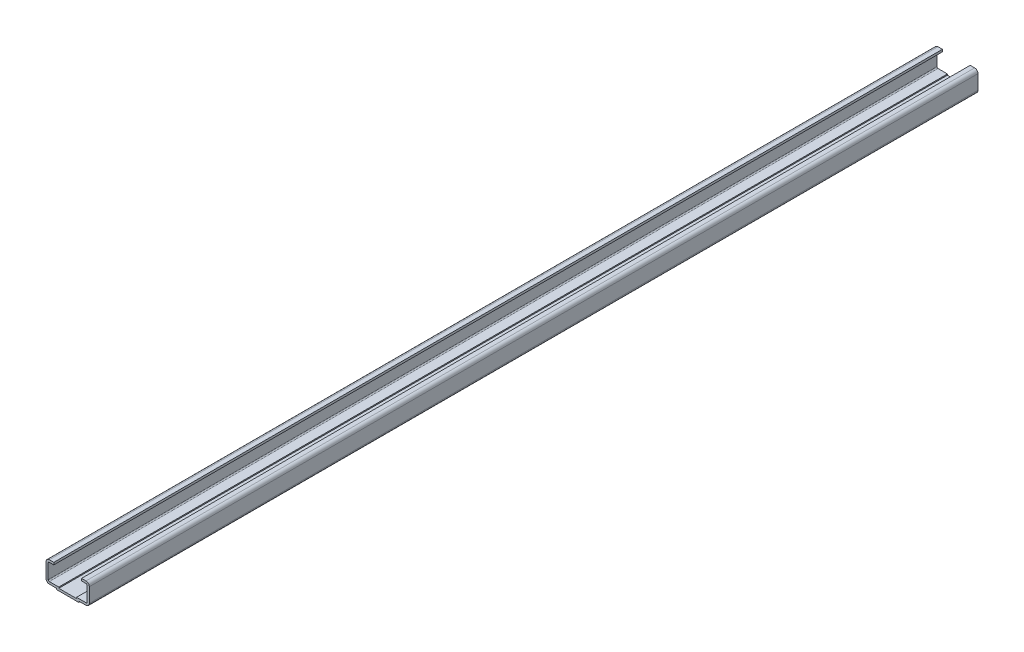
from build123d import *

# Parameters (mm, degrees)
BASE_EXTRU_MINCE_DEPTH = 400
CONG_1_R               = 1.5
CONG_2_R               = 0.5


with BuildPart() as part:
    # Esquisse1 → Base-Extru.-Mince (new body)
    with BuildSketch(Plane.XY):
        Polygon((-6.25, 10), (-9.75, 10), (-9.75, 0.5), (-5, 0.5), (-5, 0), (5, 0), (5, 0.5), (9.75, 0.5), (9.75, 10), (6.25, 10), (6.25, 9), (8.75, 9), (8.75, 1.5), (4, 1.5), (4, 1), (-4, 1), (-4, 1.5), (-8.75, 1.5), (-8.75, 9), (-6.25, 9), align=None)
    extrude(amount=BASE_EXTRU_MINCE_DEPTH)

    # Congé1
    cong_1_edges = [part.edges().sort_by_distance(p)[0] for p in [
        (-9.75, 10, 200),
        (-9.75, 0.5, 200),
        (9.75, 0.5, 200),
        (9.75, 10, 200),
    ]]
    fillet(cong_1_edges, radius=CONG_1_R)

    # Congé2
    cong_2_edges = [part.edges().sort_by_distance(p)[0] for p in [
        (-8.75, 9, 200),
        (-8.75, 1.5, 200),
        (8.75, 1.5, 200),
        (8.75, 9, 200),
    ]]
    fillet(cong_2_edges, radius=CONG_2_R)


solid = part.part
